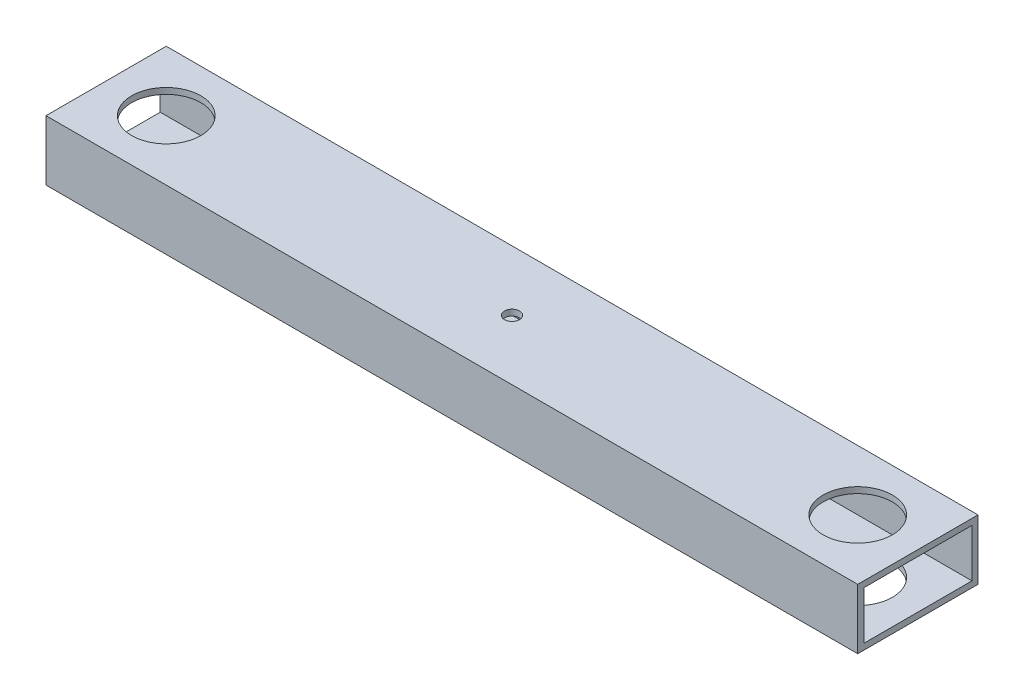
from build123d import *

# Parameters (mm, degrees)
SKETCH1_W           = 50.8
SKETCH1_H           = 25.4
SKETCH1_W_2         = 45.72
SKETCH1_H_2         = 20.32
BOSS_EXTRUDE1_DEPTH = 342.9
SKETCH2_R           = 14.605
CUT_EXTRUDE1_DEPTH  = 345.776347797
SKETCH6_R           = 3.175
CUT_EXTRUDE5_DEPTH  = 345.776347797


with BuildPart() as part:
    # Sketch1 → Boss-Extrude1 (new body)
    with BuildSketch(Plane(origin=(0, 0, 0), x_dir=(0, 0, -1), z_dir=(1, 0, 0))):
        Rectangle(SKETCH1_W, SKETCH1_H)
        Rectangle(SKETCH1_W_2, SKETCH1_H_2, mode=Mode.SUBTRACT)
    extrude(amount=BOSS_EXTRUDE1_DEPTH)

    # Sketch2 → Cut-Extrude1 (cut, through all)
    with BuildSketch(Plane.XZ.offset(12.7)):
        with Locations(Location((25.4, 0, 0), (0, 0, 270))):
            Circle(SKETCH2_R)
        with Locations(Location((317.5, 0, 0), (0, 0, 270))):
            Circle(SKETCH2_R)
    extrude(amount=-CUT_EXTRUDE1_DEPTH, mode=Mode.SUBTRACT)

    # Sketch6 → Cut-Extrude5 (cut, through all)
    with BuildSketch(Plane.XZ.offset(12.7)):
        with Locations(Location((171.45, 0, 0), (0, 0, 270))):
            Circle(SKETCH6_R)
    extrude(amount=-CUT_EXTRUDE5_DEPTH, mode=Mode.SUBTRACT)


solid = part.part
